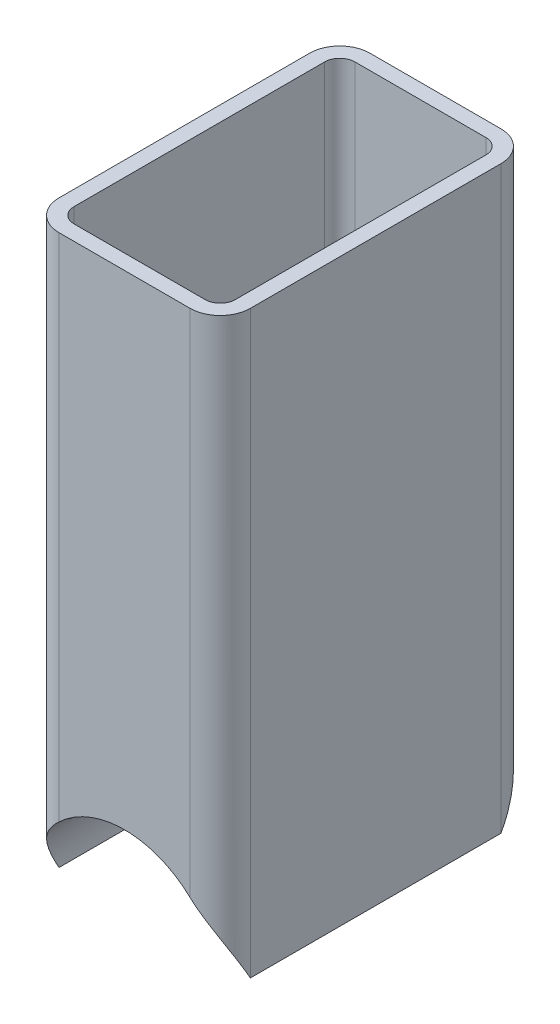
from build123d import *

# Parameters (mm, degrees)
AUFSATZ_LINEAR_AUSTRAGEN1_DEPTH      = 242.5
SCHNITT_LINEAR_AUSTRAGEN1_DEPTH      = 255.22676885017438
SCHNITT_LINEAR_AUSTRAGEN1_DEPTH_BACK = 255.22676885017438
SKIZZE2_R                            = 40


with BuildPart() as part:
    # Skizze1 → Aufsatz-Linear austragen1 (new body)
    with BuildSketch(Plane(origin=(0, 0, 0), x_dir=(1, 0, 0), z_dir=(0, 1, 0))):
        with BuildLine():
            Line((-27.399999999999988, -65), (27.400000000000016, -65.00000000000001))
            ThreePointArc((27.400000000000016, -65.00000000000001), (36.30954544295052, -61.30954544295051), (40.00000000000002, -52.400000000000006))
            Line((40.00000000000002, -52.400000000000006), (40, 52.400000000000006))
            ThreePointArc((40, 52.400000000000006), (36.309545442950494, 61.30954544295051), (27.4, 65))
            Line((27.4, 65), (-27.399999999999995, 64.99999999999997))
            ThreePointArc((-27.399999999999995, 64.99999999999997), (-36.30954544295047, 61.30954544295047), (-39.99999999999999, 52.39999999999999))
            Line((-39.99999999999999, 52.39999999999999), (-39.999999999999986, -52.400000000000006))
            ThreePointArc((-39.999999999999986, -52.400000000000006), (-36.30954544295049, -61.3095454429505), (-27.399999999999988, -65))
        make_face()
        with BuildLine():
            Line((-27.39999999999999, -58.7), (27.400000000000016, -58.7))
            ThreePointArc((27.400000000000016, -58.7), (31.854772721475264, -56.85477272147525), (33.70000000000002, -52.400000000000006))
            Line((33.70000000000002, -52.400000000000006), (33.7, 52.400000000000006))
            ThreePointArc((33.7, 52.400000000000006), (31.854772721475253, 56.85477272147526), (27.400000000000002, 58.7))
            Line((27.400000000000002, 58.7), (-27.39999999999999, 58.7))
            ThreePointArc((-27.39999999999999, 58.7), (-31.854772721475243, 56.85477272147526), (-33.69999999999999, 52.400000000000006))
            Line((-33.69999999999999, 52.400000000000006), (-33.69999999999999, -52.400000000000006))
            ThreePointArc((-33.69999999999999, -52.400000000000006), (-31.85477272147524, -56.85477272147525), (-27.39999999999999, -58.7))
        make_face(mode=Mode.SUBTRACT)
    extrude(amount=AUFSATZ_LINEAR_AUSTRAGEN1_DEPTH)

    # Skizze2 → Schnitt-Linear austragen1 (cut, two sides: drawn at the far end of the back side and taken through both)
    with BuildSketch(Plane.XY.offset(-SCHNITT_LINEAR_AUSTRAGEN1_DEPTH_BACK)):
        Circle(SKIZZE2_R)
    extrude(amount=SCHNITT_LINEAR_AUSTRAGEN1_DEPTH + SCHNITT_LINEAR_AUSTRAGEN1_DEPTH_BACK, mode=Mode.SUBTRACT)


solid = part.part
